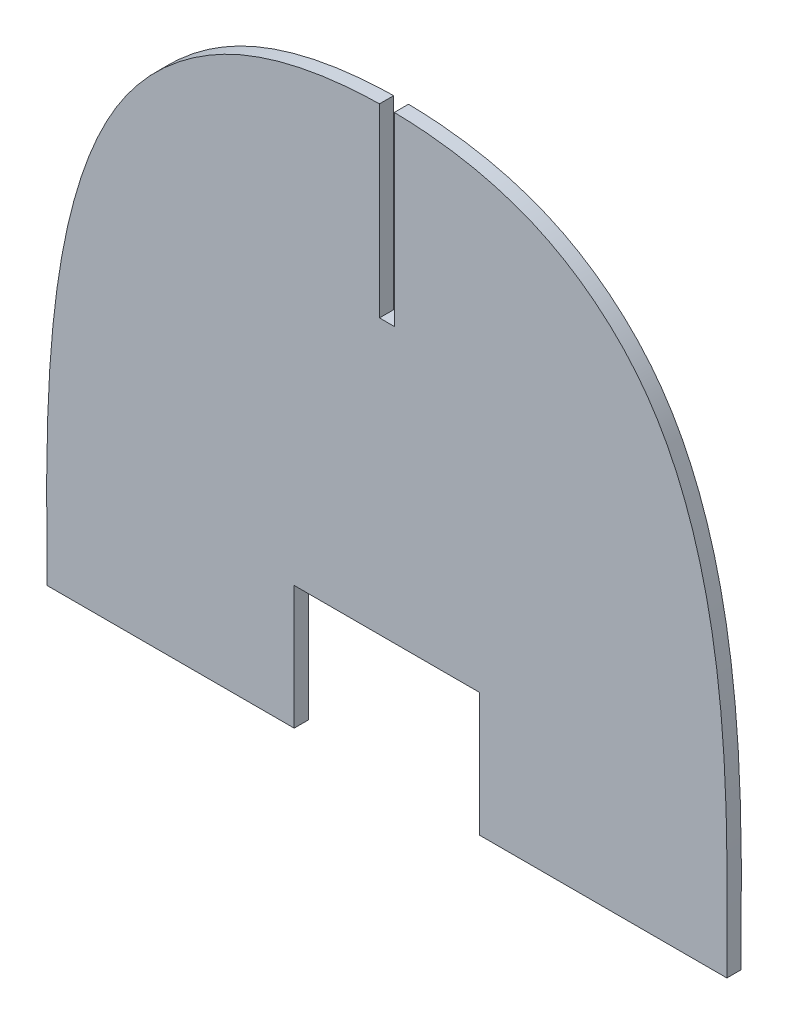
from build123d import *

# Parameters (mm, degrees)
BOSS_EXTRUDE1_DEPTH = 5.842
SKETCH3_W           = 38.1
SKETCH3_H           = 50.8
SKETCH3_W_2         = 3.048
SKETCH3_H_2         = 76.2
CUT_EXTRUDE1_DEPTH  = 313.482729861


with BuildPart() as part:
    # Sketch2 → Boss-Extrude1 (new body)
    with BuildSketch(Plane.XY):
        with BuildLine():
            Line((139.7, 39.6875), (0, 39.6875))
            Line((0, 39.6875), (0, 279.4))
            add(Edge.make_bspline(
                [(0, 279.4), (19.778752967, 279.4), (60.712106625, 273.845268019), (104.060068029, 240.096596199), (142.840222691, 163.904467187), (139.7, 82.996585267), (139.7, 39.6875)],
                knots=[0, 0, 0, 0, 0.19466083, 0.367201975, 0.497163256, 1, 1, 1, 1], degree=3))
        make_face()
    extrude(amount=BOSS_EXTRUDE1_DEPTH)

    # Sketch3 → Cut-Extrude1 (cut, through all)
    with BuildSketch(Plane.XY.offset(5.842)):
        with Locations((19.05, 65.0875)):
            Rectangle(SKETCH3_W, SKETCH3_H)
        with Locations((1.524, 241.3)):
            Rectangle(SKETCH3_W_2, SKETCH3_H_2)
    extrude(amount=-CUT_EXTRUDE1_DEPTH, mode=Mode.SUBTRACT)

    # Mirror1: part across plane


with BuildPart() as part_1:
    add(part.part)
    add(part.part.mirror(Plane(origin=(0, 0, 0), x_dir=(0, 0, 1), z_dir=(1, 0, 0))))


solid = part_1.part
